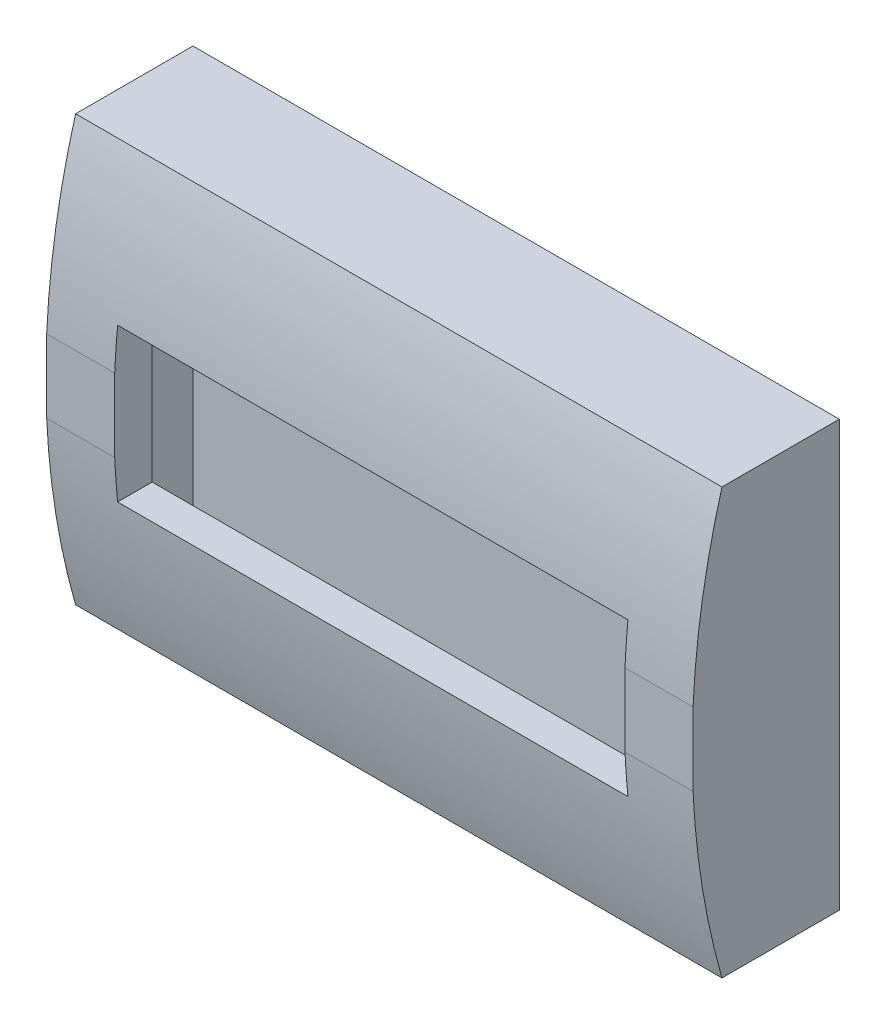
from build123d import *

# Parameters (mm, degrees)
CROQUIS1_W              = 380
CROQUIS1_H              = 250
SALIENTE_EXTRUIR1_DEPTH = 64
CROQUIS2_W              = 372
CROQUIS2_H              = 242
CORTAR_EXTRUIR1_DEPTH   = 60
CROQUIS3_W              = 380
CROQUIS3_H              = 250
SALIENTE_EXTRUIR2_DEPTH = 22
CROQUIS5_W              = 300
CROQUIS5_H              = 90
CORTAR_EXTRUIR3_DEPTH   = 41
CORTAR_EXTRUIR2_REACH   = 411.171


with BuildPart() as part:
    # Croquis1 → Saliente-Extruir1 (new body)
    with BuildSketch(Plane.XY):
        Rectangle(CROQUIS1_W, CROQUIS1_H)
    extrude(amount=SALIENTE_EXTRUIR1_DEPTH)

    # Croquis2 → Cortar-Extruir1 (cut)
    with BuildSketch(Plane.XY.offset(64)):
        Rectangle(CROQUIS2_W, CROQUIS2_H)
    extrude(amount=-CORTAR_EXTRUIR1_DEPTH, mode=Mode.SUBTRACT)

    # Croquis3 → Saliente-Extruir2 (add)
    with BuildSketch(Plane.XY.offset(64)):
        Rectangle(CROQUIS3_W, CROQUIS3_H)
    extrude(amount=SALIENTE_EXTRUIR2_DEPTH)

    # Croquis5 → Cortar-Extruir3 (cut)
    with BuildSketch(Plane.XY.offset(86)):
        Rectangle(CROQUIS5_W, CROQUIS5_H)
    extrude(amount=-CORTAR_EXTRUIR3_DEPTH, mode=Mode.SUBTRACT)

    # Cortar-Extruir2: up to this face of the body (flat: up to its plane)
    cortar_extruir2_end = Plane(part.part.faces().sort_by_distance((190, 0, 43))[0])
    # Croquis4 → Cortar-Extruir2 (cut, up to the picked face)
    with BuildSketch(Plane.ZY.offset(190), mode=Mode.PRIVATE) as cortar_extruir2_sk1:
        with BuildLine():
            Line((69, 125), (69, 152.478721162))
            Line((69, 152.478721162), (170.671845975, 152.478721162))
            Line((170.671845975, 152.478721162), (170.671845975, -144.88621918))
            Line((170.671845975, -144.88621918), (69, -144.88621918))
            Line((69, -144.88621918), (69, -125))
            ThreePointArc((69, -125), (86.50817069, 0), (69, 125))
        make_face()
    cortar_extruir2_tool1 = split(extrude(cortar_extruir2_sk1.sketch, amount=-CORTAR_EXTRUIR2_REACH, mode=Mode.PRIVATE), bisect_by=cortar_extruir2_end, keep=Keep.BOTH, mode=Mode.PRIVATE)
    add(cortar_extruir2_tool1.solids().sort_by(Axis((-190, 4.203548, 124.537441), (1, 0, 0)))[0], mode=Mode.SUBTRACT)


solid = part.part
